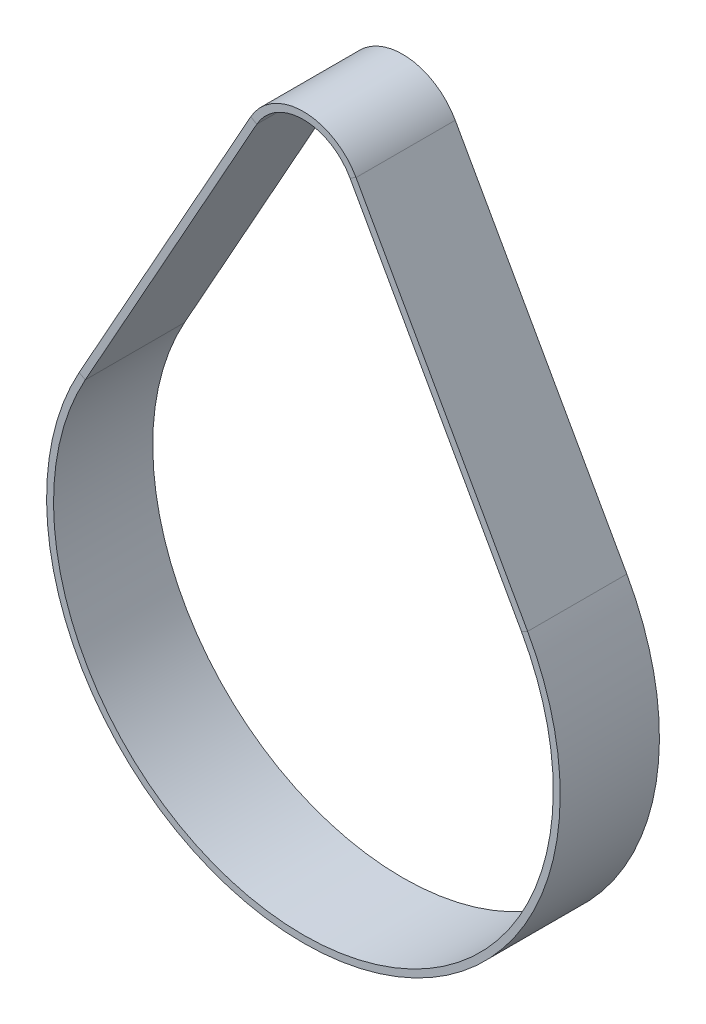
from build123d import *

# Parameters (mm, degrees)
SKETCH2_W = 9
SKETCH2_H = 0.63


with BuildPart() as part:
    # Sweep1: sweep along a path in Sketch1
    with BuildLine(Plane.XY) as sweep1_path:
        Line((-4.446595778, 39.043144983), (-20.009681003, 11.174152424))
        ThreePointArc((-20.009681003, 11.174152424), (0, -22.91831181), (20.009681003, 11.174152424))
        Line((20.009681003, 11.174152424), (4.446595778, 39.043144983))
        ThreePointArc((4.446595778, 39.043144983), (0, 41.65295818), (-4.446595778, 39.043144983))
    # Sketch2 → Sweep1 (sweep)
    with BuildSketch(Plane(origin=(0, 0, 0), x_dir=(0, 0, -1), z_dir=(-0.48756437718818374, 0.8730870392447128, 0))):
        with Locations((0, -22.97931181)):
            Rectangle(SKETCH2_W, SKETCH2_H)
    sweep(path=sweep1_path.line)


solid = part.part
